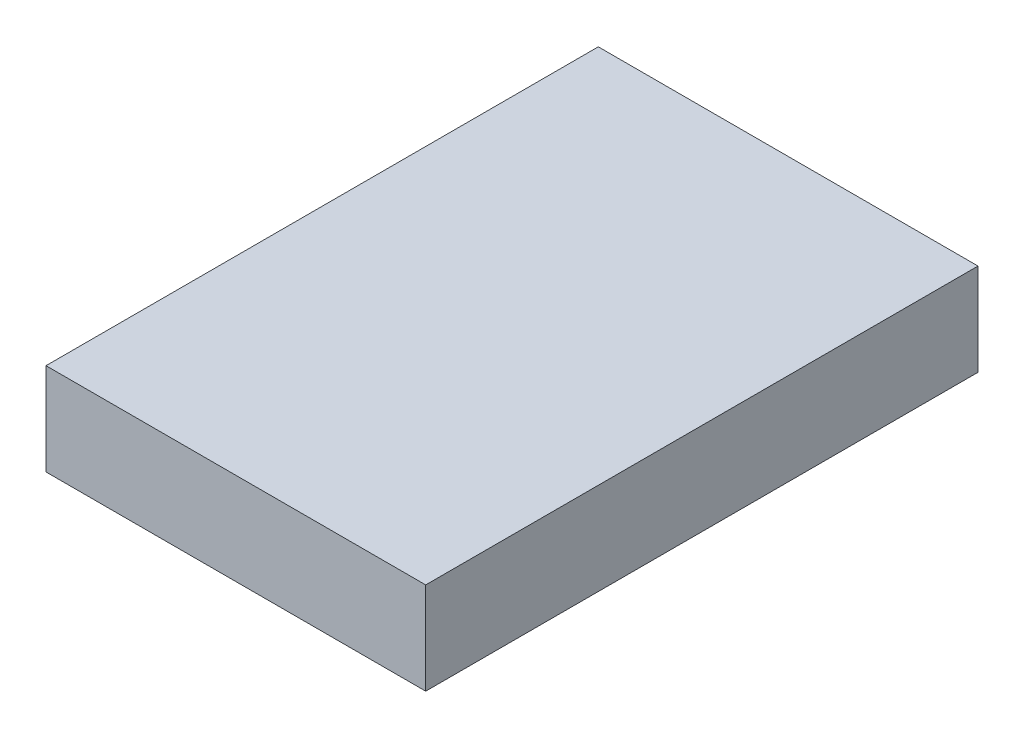
from build123d import *

# Parameters (mm, degrees)
SKETCH1_W           = 16.5
SKETCH1_H           = 24
BOSS_EXTRUDE1_DEPTH = 4


with BuildPart() as part:
    # Sketch1 → Boss-Extrude1 (new body)
    with BuildSketch(Plane(origin=(0, 0, 0), x_dir=(1, 0, 0), z_dir=(0, 1, 0))):
        Rectangle(SKETCH1_W, SKETCH1_H)
    extrude(amount=BOSS_EXTRUDE1_DEPTH)


solid = part.part
